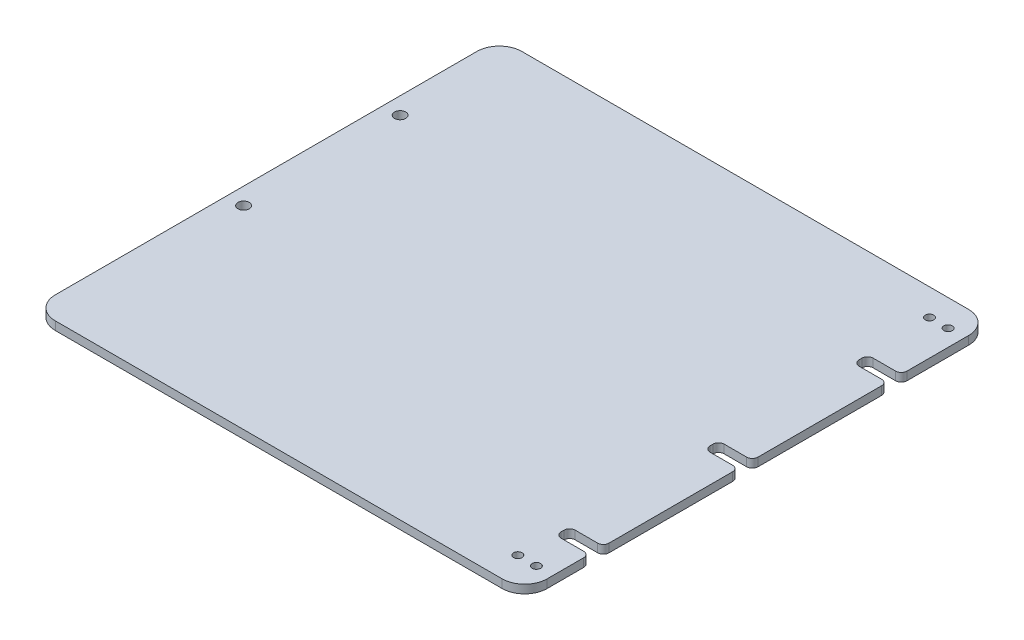
from build123d import *

# Parameters (mm, degrees)
SKETCH_1_W          = 175
SKETCH_1_H          = 166
SKETCH_1_R          = 2
EXTRUDE_1_DEPTH     = 3
SKETCH_2_W          = 12
SKETCH_2_H          = 5
CUT_EXTRUDE_1_DEPTH = 242.226035079
FILLET_1_R          = 2
FILLET_2_R          = 8
SKETCH_4_R          = 1.5
CUT_EXTRUDE_3_DEPTH = 242.226035079


with BuildPart() as part:
    # 草图1 → 凸台-拉伸1 (new body)
    with BuildSketch(Plane(origin=(0, 0, 0), x_dir=(1, 0, 0), z_dir=(0, 1, 0))):
        with Locations((87.5, 83)):
            Rectangle(SKETCH_1_W, SKETCH_1_H)
        with Locations(Location((6, 124.7, 0), (0, 0, 270))):
            Circle(SKETCH_1_R, mode=Mode.SUBTRACT)
        with Locations(Location((6, 69, 0), (0, 0, 270))):
            Circle(SKETCH_1_R, mode=Mode.SUBTRACT)
    extrude(amount=EXTRUDE_1_DEPTH)

    # 草图2 → 切除-拉伸1 (cut, through all)
    with BuildSketch(Plane(origin=(0, 3, 0), x_dir=(1, 0, 0), z_dir=(0, 1, 0))):
        with Locations((169, 131.5)):
            Rectangle(SKETCH_2_W, SKETCH_2_H)
        with Locations((169, 78.5)):
            Rectangle(SKETCH_2_W, SKETCH_2_H)
        with Locations((169, 25.5)):
            Rectangle(SKETCH_2_W, SKETCH_2_H)
    extrude(amount=-CUT_EXTRUDE_1_DEPTH, mode=Mode.SUBTRACT)

    # 圆角1
    fillet_1_edges = [part.edges().sort_by_distance(p)[0] for p in [
        (175, 1.5, -134),
        (175, 1.5, -129),
        (163, 1.5, -129),
        (163, 1.5, -134),
        (175, 1.5, -81),
        (175, 1.5, -76),
        (163, 1.5, -76),
        (163, 1.5, -81),
        (175, 1.5, -28),
        (175, 1.5, -23),
        (163, 1.5, -23),
        (163, 1.5, -28),
    ]]
    fillet(fillet_1_edges, radius=FILLET_1_R)

    # 圆角2
    fillet_2_edges = [part.edges().sort_by_distance(p)[0] for p in [
        (0, 1.5, -166),
        (175, 1.5, -166),
        (175, 1.5, 0),
        (0, 1.5, 0),
    ]]
    fillet(fillet_2_edges, radius=FILLET_2_R)

    # 草图4 → 切除-拉伸3 (cut, through all)
    with BuildSketch(Plane(origin=(0, 3, 0), x_dir=(1, 0, 0), z_dir=(0, 1, 0))):
        with Locations(Location((162.499025796, 10.082661759, 0), (0, 0, 270))):
            Circle(SKETCH_4_R)
        with Locations(Location((169.107894404, 10.082661759, 0), (0, 0, 270))):
            Circle(SKETCH_4_R)
        with Locations(Location((162.499025796, 156.544971591, 0), (0, 0, 270))):
            Circle(SKETCH_4_R)
        with Locations(Location((169.107894404, 156.544971591, 0), (0, 0, 270))):
            Circle(SKETCH_4_R)
    extrude(amount=-CUT_EXTRUDE_3_DEPTH, mode=Mode.SUBTRACT)


solid = part.part
